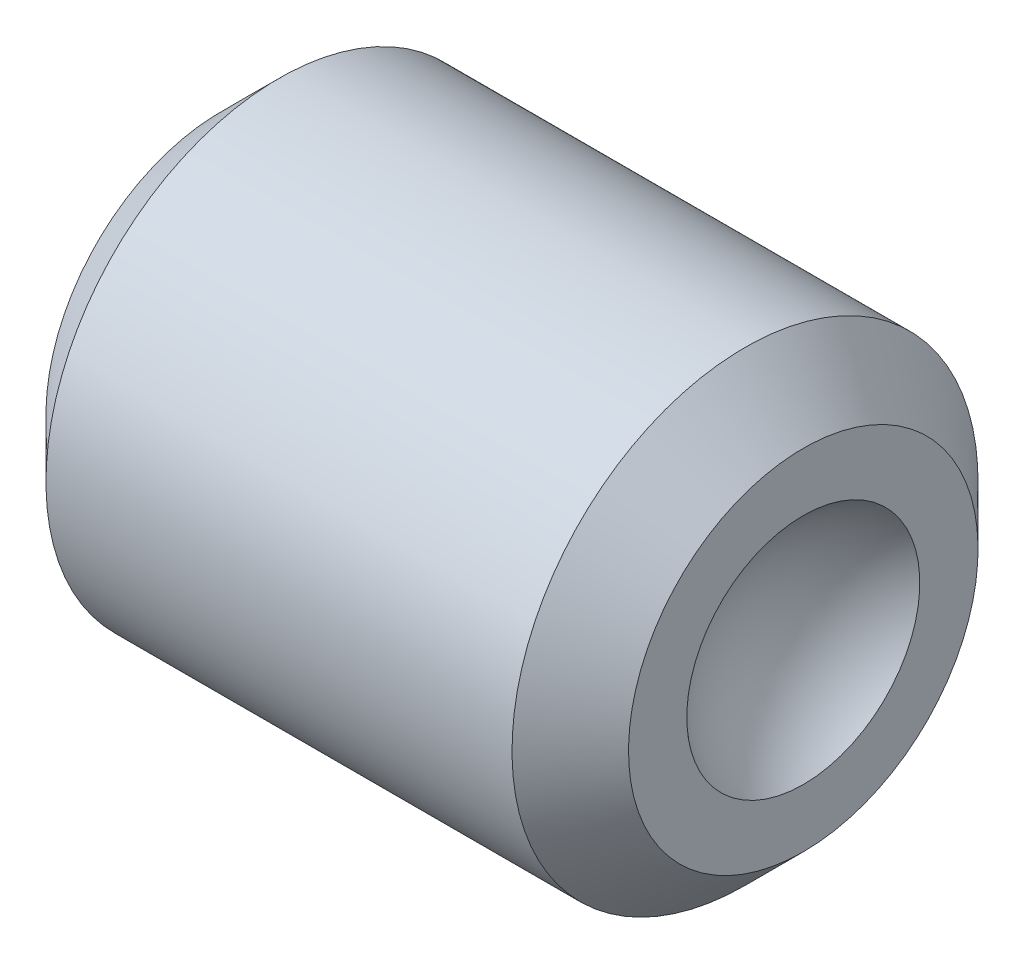
from build123d import *

# Parameters (mm, degrees)
CUT_EXTRUDE1_DEPTH = 3


with BuildPart() as part:
    # Sketch1 → Revolve1 (revolve)
    with BuildSketch(Plane.XY, mode=Mode.PRIVATE) as revolve1_sk:
        with BuildLine():
            Line((0, 0), (0, 1.5))
            Line((0, 1.5), (0.5, 2))
            Line((0.5, 2), (4.5, 2))
            Line((4.5, 2), (5, 1.5))
            Line((5, 1.5), (5, 1))
            ThreePointArc((5, 1), (4.631966011, 0.559016994), (4.5, 0))
            Line((4.5, 0), (0, 0))
        make_face()
    revolve(revolve1_sk.sketch.rotate(Axis((0, 0, 0), (1, 0, 0)), 180), axis=Axis((0, 0, 0), (1, 0, 0)))

    # Sketch2 → Cut-Extrude1 (cut)
    with BuildSketch(Plane.ZY):
        Polygon((0, 1.154700538), (-1, 0.577350269), (-1, -0.577350269), (0, -1.154700538), (1, -0.577350269), (1, 0.577350269), align=None)
    extrude(amount=-CUT_EXTRUDE1_DEPTH, mode=Mode.SUBTRACT)


solid = part.part
